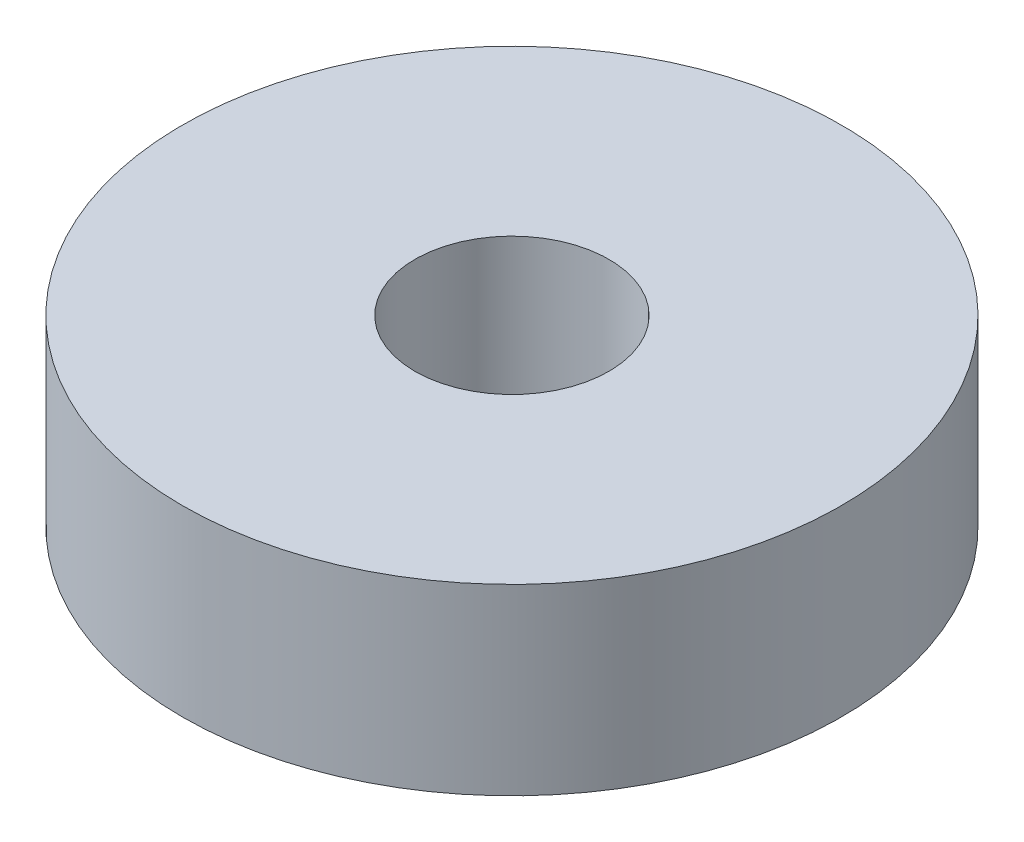
from build123d import *

# Parameters (mm, degrees)
SKETCH1_R           = 9
BOSS_EXTRUDE1_DEPTH = 5
SKETCH2_R           = 2.65
CUT_EXTRUDE1_DEPTH  = 14.674794331


with BuildPart() as part:
    # Sketch1 → Boss-Extrude1 (new body)
    with BuildSketch(Plane(origin=(0, 0, 0), x_dir=(1, 0, 0), z_dir=(0, 1, 0))):
        with Locations(Location((0, 0, 0), (0, 0, 270))):
            Circle(SKETCH1_R)
    extrude(amount=BOSS_EXTRUDE1_DEPTH)

    # Sketch2 → Cut-Extrude1 (cut, through all)
    with BuildSketch(Plane(origin=(0, 5, 0), x_dir=(1, 0, 0), z_dir=(0, 1, 0))):
        with Locations(Location((0, 0, 0), (0, 0, 270))):
            Circle(SKETCH2_R)
    extrude(amount=-CUT_EXTRUDE1_DEPTH, mode=Mode.SUBTRACT)


solid = part.part
